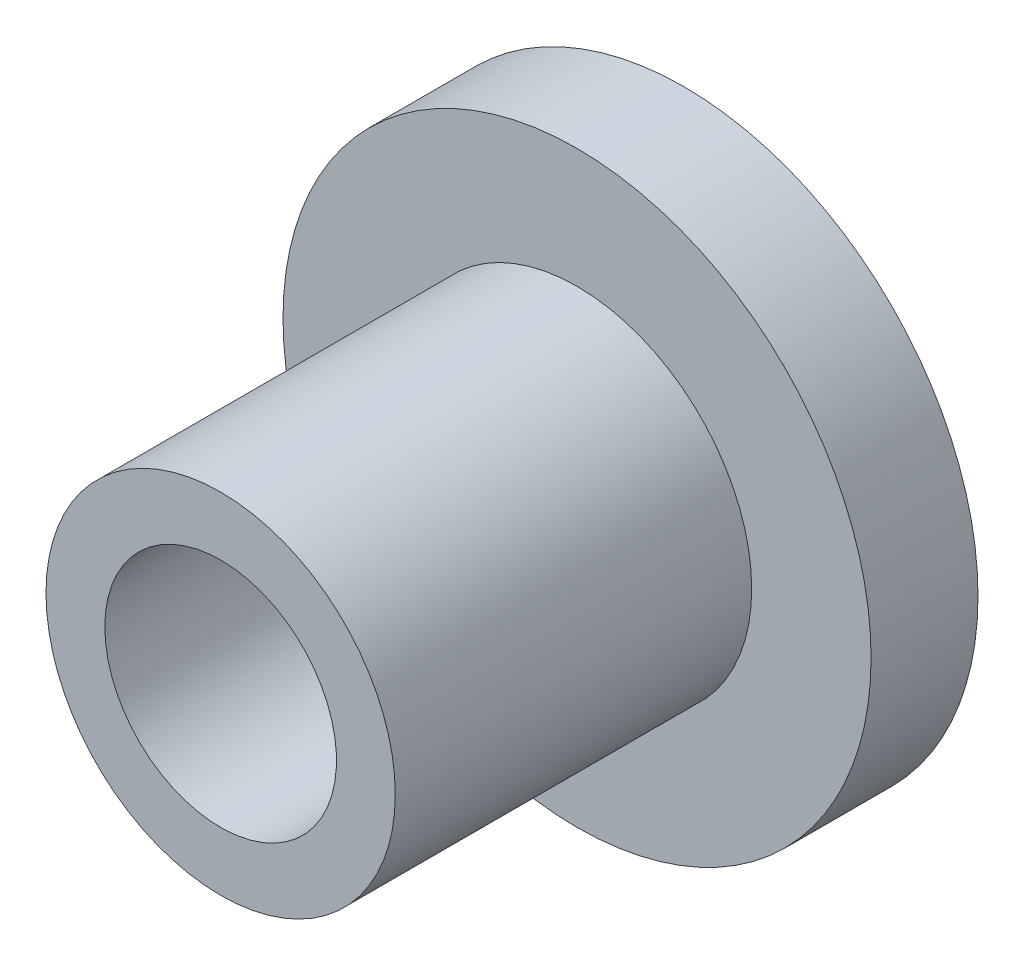
from build123d import *

# Parameters (mm, degrees)
SKETCH1_R               = 8.25
SKETCH1_R_2             = 3.25
BOSS_EXTRUDE1_DEPTH     = 13
CUT_EXTRUDE_THIN1_START = -3
SKETCH2_R               = 14.9
SKETCH2_R_2             = 4.9
CUT_EXTRUDE_THIN1_DEPTH = 13


with BuildPart() as part:
    # Sketch1 → Boss-Extrude1 (new body)
    with BuildSketch(Plane.XY):
        with Locations(Location((0, 0, 0), (0, 0, 180))):
            Circle(SKETCH1_R)
        with Locations(Location((0, 0, 0), (0, 0, 180))):
            Circle(SKETCH1_R_2, mode=Mode.SUBTRACT)
    extrude(amount=BOSS_EXTRUDE1_DEPTH)

    # Sketch2 → Cut-Extrude-Thin1 (cut)
    with BuildSketch(Plane(origin=(0, 0, 0), x_dir=(-1, 0, 0), z_dir=(0, 0, -1)).offset(CUT_EXTRUDE_THIN1_START)):
        Circle(SKETCH2_R)
        Circle(SKETCH2_R_2, mode=Mode.SUBTRACT)
    extrude(amount=-CUT_EXTRUDE_THIN1_DEPTH, mode=Mode.SUBTRACT)


solid = part.part
